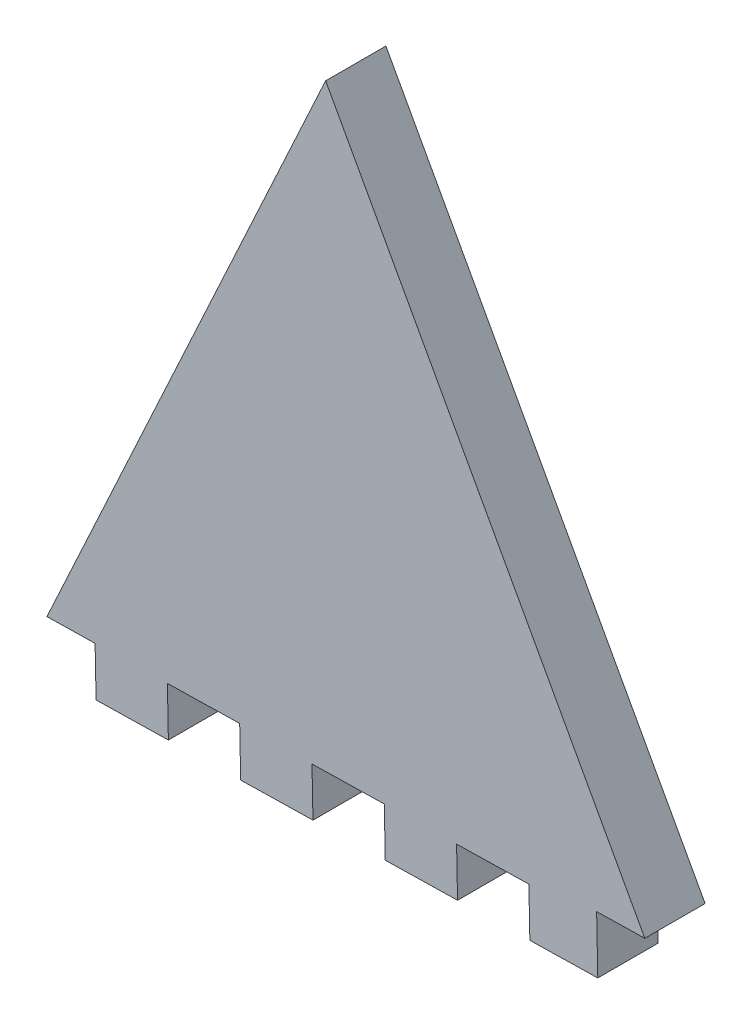
from build123d import *

# Parameters (mm, degrees)
BOSS_EXTRUDE1_DEPTH = 3.175


with BuildPart() as part:
    # Sketch1 → Boss-Extrude1 (new body)
    with BuildSketch(Plane.XY):
        Polygon((-16.340579623, 2.232078974), (-1.653374253, 34.026194212), (15.164775792, 3.306012012), (12.625289947, 3.254907807), (12.685653892, 0.255284057), (9.105793396, 0.18324352), (9.054689192, 2.722729366), (5.245460423, 2.64607306), (5.296564628, 0.106587214), (1.487335859, 0.029930907), (1.436231655, 2.569416753), (-2.372997114, 2.492760447), (-2.321892909, -0.046725399), (-6.131121678, -0.123381706), (-6.18263624, 2.436495791), (-9.991865009, 2.359839484), (-9.940350446, -0.200038012), (-13.749579215, -0.276694319), (-13.801093777, 2.283183178), align=None)
    extrude(amount=BOSS_EXTRUDE1_DEPTH)


solid = part.part
